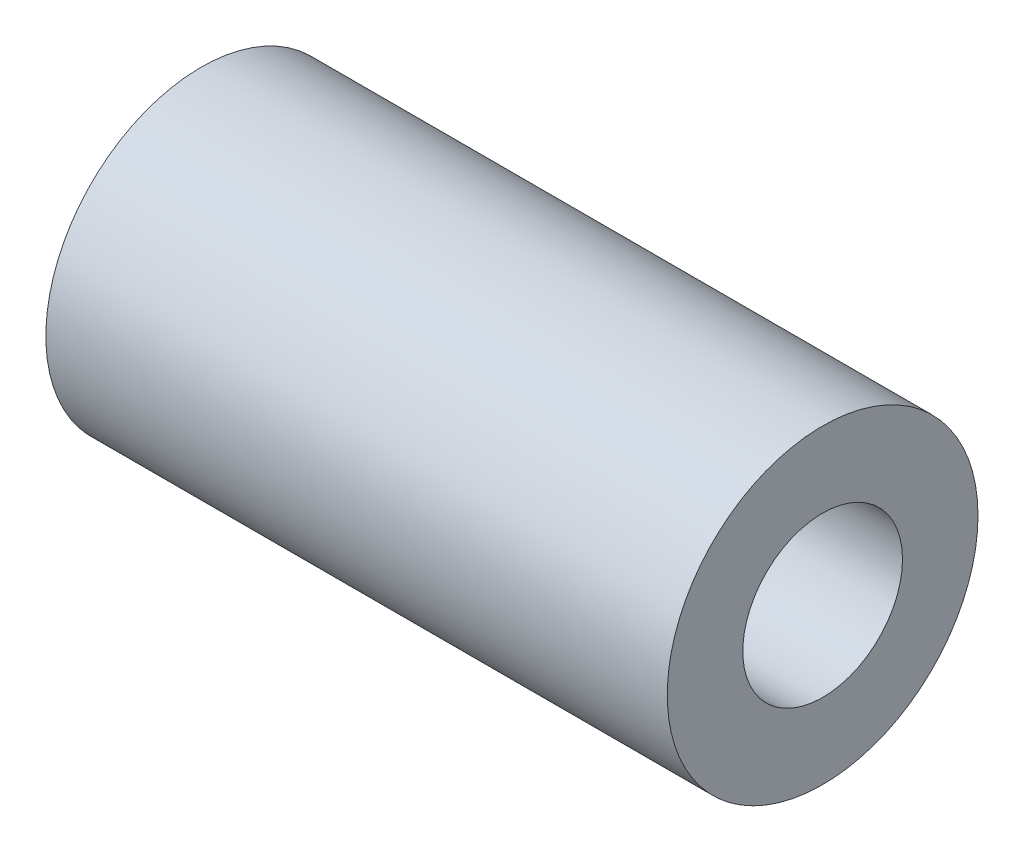
from build123d import *

# Parameters (mm, degrees)
SKETCH2_R           = 6.35
SKETCH2_R_2         = 3.2639
BOSS_EXTRUDE1_DEPTH = 25.4


with BuildPart() as part:
    # Sketch2 → Boss-Extrude1 (new body)
    with BuildSketch(Plane(origin=(0, 0, 0), x_dir=(0, 0, -1), z_dir=(1, 0, 0))):
        Circle(SKETCH2_R)
        Circle(SKETCH2_R_2, mode=Mode.SUBTRACT)
    extrude(amount=BOSS_EXTRUDE1_DEPTH)


solid = part.part
